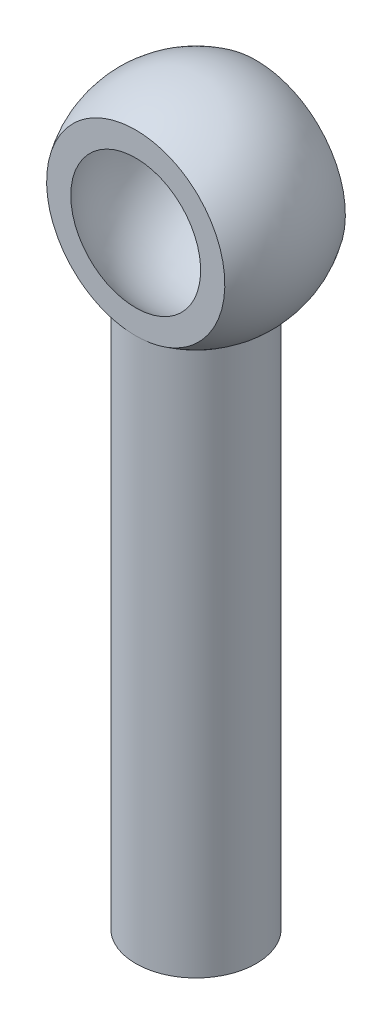
from build123d import *

# Parameters (mm, degrees)
SKETCH1_R               = 4.7625
BOSS_EXTRUDE1_DEPTH     = 50
CUT_EXTRUDE2_DEPTH      = 60.722273902
CUT_EXTRUDE2_DEPTH_BACK = 60.722273902
SKETCH4_W               = 5
SKETCH4_H               = 14.540496698


with BuildPart() as part:
    # Sketch1 → Boss-Extrude1 (new body)
    with BuildSketch(Plane(origin=(0, 0, 0), x_dir=(1, 0, 0), z_dir=(0, 1, 0))):
        with Locations(Location((0, 0, 0), (0, 0, 270))):
            Circle(SKETCH1_R)
    extrude(amount=BOSS_EXTRUDE1_DEPTH)

    # Sketch2 → Revolve4 (revolve)
    with BuildSketch(Plane.XY):
        with BuildLine():
            Line((0, 58.5), (0, 41.5))
            ThreePointArc((0, 41.5), (-8.5, 50), (0, 58.5))
        make_face()
    revolve(axis=Axis((0, 58.5, 0), (0, -1, 0)))

    # Sketch4 → Cut-Extrude2 (cut, two sides: drawn at the far end of the back side and taken through both)
    with BuildSketch(Plane(origin=(0, 0, 0), x_dir=(0, 0, -1), z_dir=(1, 0, 0)).offset(-CUT_EXTRUDE2_DEPTH_BACK)):
        with Locations((-7.2625, 50.229751651)):
            Rectangle(SKETCH4_W, SKETCH4_H)
        with Locations((7.26, 50.229751651)):
            Rectangle(SKETCH4_W, SKETCH4_H)
    extrude(amount=CUT_EXTRUDE2_DEPTH + CUT_EXTRUDE2_DEPTH_BACK, mode=Mode.SUBTRACT)

    # Sketch5 → Cut-Revolve1 (revolve, cut)
    with BuildSketch(Plane.XY):
        with BuildLine():
            Line((0, 57), (0, 43))
            ThreePointArc((0, 43), (-7, 50), (0, 57))
        make_face()
    revolve(axis=Axis((0, 57, 0), (0, -1, 0)), mode=Mode.SUBTRACT)


solid = part.part
